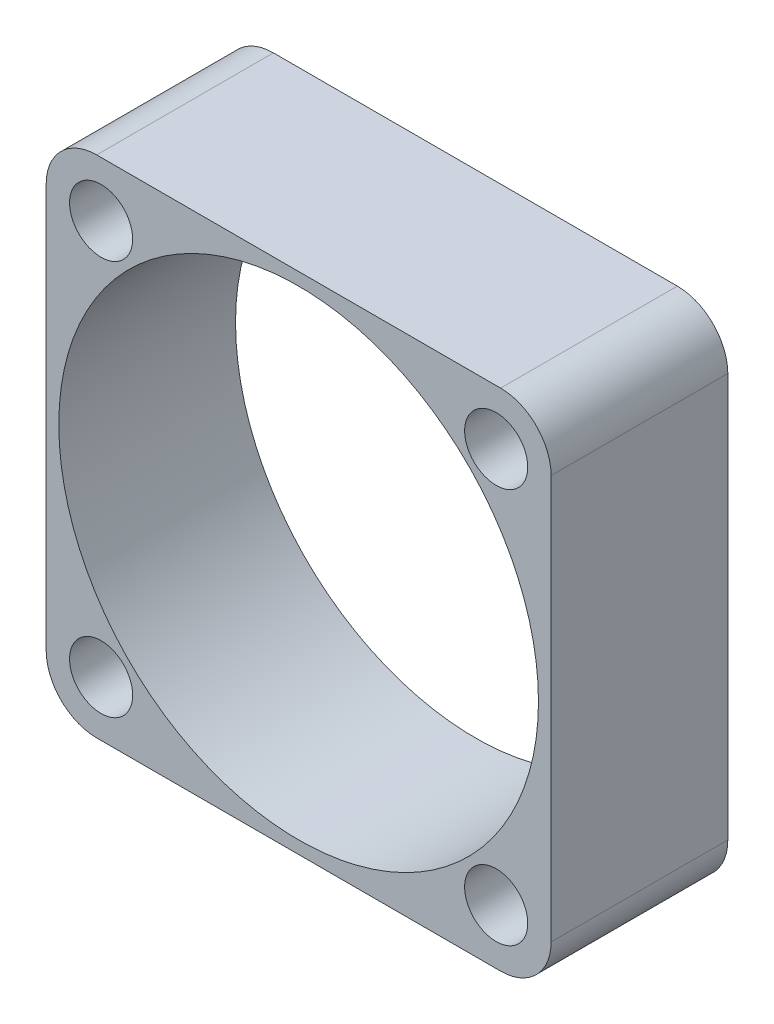
from build123d import *

# Parameters (mm, degrees)
SKETCH1_W           = 20
SKETCH1_H           = 20
SKETCH1_R           = 9.5
BOSS_EXTRUDE1_DEPTH = 7
FILLET1_R           = 2
SKETCH2_R           = 1.25
CUT_EXTRUDE1_DEPTH  = 16.779733838


with BuildPart() as part:
    # Sketch1 → Boss-Extrude1 (new body)
    with BuildSketch(Plane.XY):
        Rectangle(SKETCH1_W, SKETCH1_H)
        Circle(SKETCH1_R, mode=Mode.SUBTRACT)
    extrude(amount=BOSS_EXTRUDE1_DEPTH)

    # Fillet1
    fillet1_edges = [part.edges().sort_by_distance(p)[0] for p in [
        (10, -10, 3.5),
        (-10, -10, 3.5),
        (-10, 10, 3.5),
        (10, 10, 3.5),
    ]]
    fillet(fillet1_edges, radius=FILLET1_R)

    # Sketch2 → Cut-Extrude1 (cut, through all)
    with BuildSketch(Plane.XY.offset(7)):
        with Locations((-7.825, 7.825)):
            Circle(SKETCH2_R)
        with Locations((7.825, 7.825)):
            Circle(SKETCH2_R)
        with Locations((7.825, -7.825)):
            Circle(SKETCH2_R)
        with Locations((-7.825, -7.825)):
            Circle(SKETCH2_R)
    extrude(amount=-CUT_EXTRUDE1_DEPTH, mode=Mode.SUBTRACT)


solid = part.part
